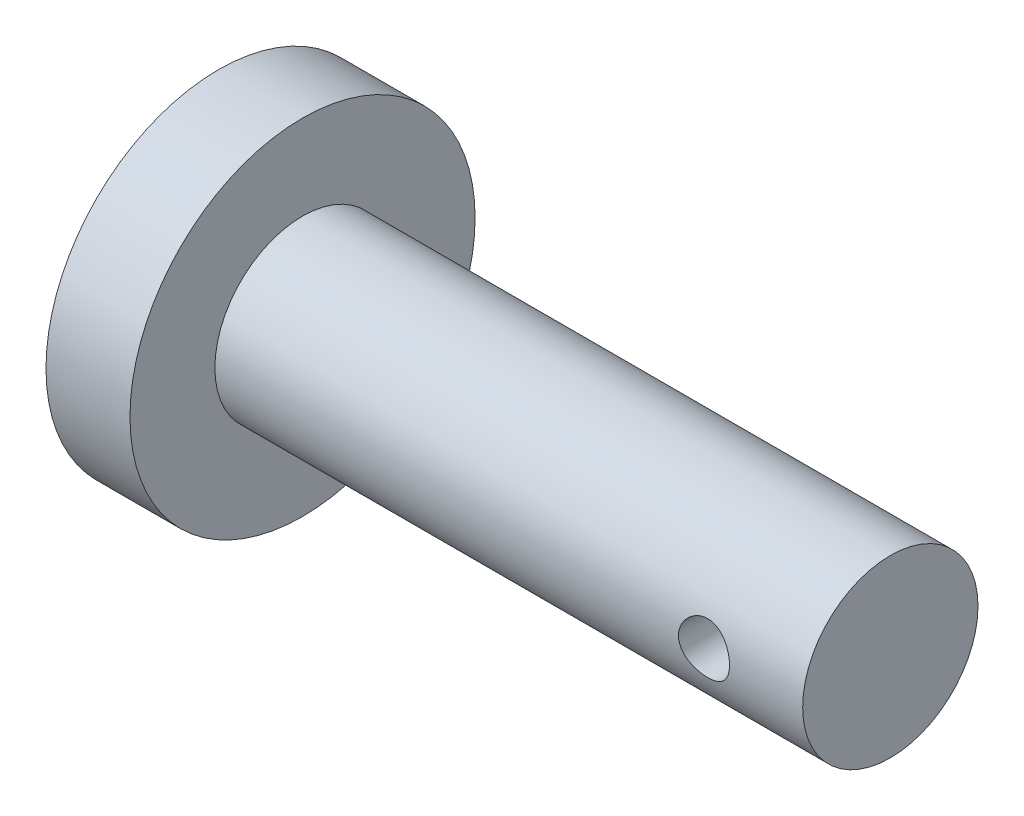
from build123d import *

# Parameters (mm, degrees)
CUT_EXTRUDE1_DEPTH      = 87.327180074
CUT_EXTRUDE1_DEPTH_BACK = 87.327180074
SKETCH2_R               = 5.183409986


with BuildPart() as part:
    # Sketch1 → Revolve2 (revolve)
    with BuildSketch(Plane.XY, mode=Mode.PRIVATE) as revolve2_sk:
        Polygon((-70.703680244, 35.024074717), (-53.659879178, 35.024074717), (-53.659879178, 17.792979134), (65.646728279, 17.792979134), (65.646728279, 0), (-70.703680244, 0), align=None)
    revolve(revolve2_sk.sketch.rotate(Axis((-70.703680244, 0, 0), (1, 0, 0)), 90), axis=Axis((-70.703680244, 0, 0), (1, 0, 0)))

    # Sketch2 → Cut-Extrude1 (cut, two sides: drawn at the far end of the back side and taken through both)
    with BuildSketch(Plane.XY.offset(-CUT_EXTRUDE1_DEPTH_BACK)):
        with Locations((45.611163079, 0)):
            Circle(SKETCH2_R)
    extrude(amount=CUT_EXTRUDE1_DEPTH + CUT_EXTRUDE1_DEPTH_BACK, mode=Mode.SUBTRACT)


solid = part.part
